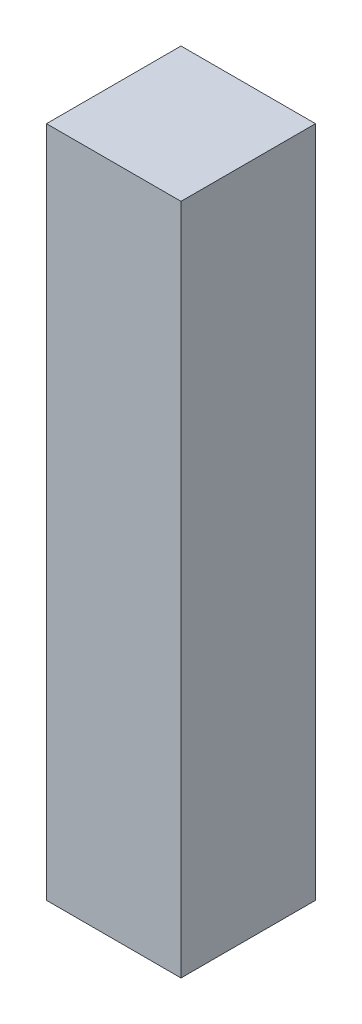
from build123d import *

# Parameters (mm, degrees)
SKETCH2_W           = 1
SKETCH2_H           = 1
BOSS_EXTRUDE1_DEPTH = 5


with BuildPart() as part:
    # Sketch2 → Boss-Extrude1 (new body)
    with BuildSketch(Plane(origin=(0, 0, 0), x_dir=(1, 0, 0), z_dir=(0, 1, 0))):
        Rectangle(SKETCH2_W, SKETCH2_H)
    extrude(amount=BOSS_EXTRUDE1_DEPTH)


solid = part.part
